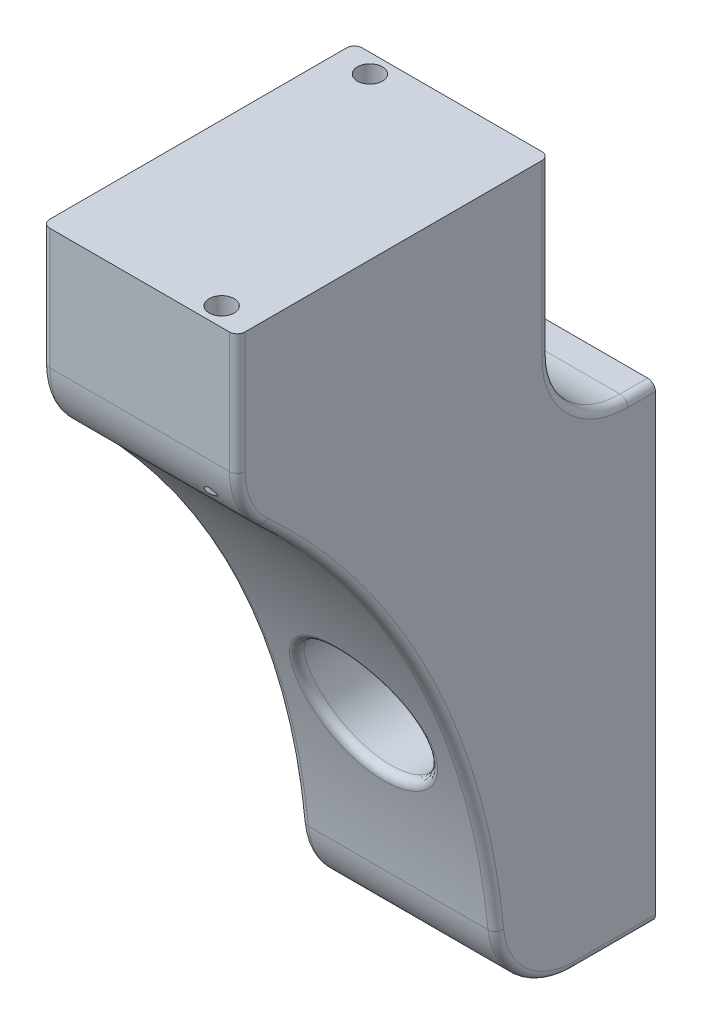
from build123d import *

# Parameters (mm, degrees)
BOSS_EXTRUDE1_DEPTH     = 7.9375
CUT_EXTRUDE1_DEPTH      = 69.000110012
CUT_EXTRUDE1_DEPTH_BACK = 69.000110012
SKETCH2_R               = 3.175
CUT_EXTRUDE4_START      = 6.35
SKETCH2_3_R             = 5.08
SKETCH2_3_R_2           = 3.175
CUT_EXTRUDE4_DEPTH      = 62.650110074
SKETCH3_R               = 1.016
CUT_EXTRUDE2_DEPTH      = 12.7
FILLET1_R               = 6.35
FILLET2_R               = 0.635


with BuildPart() as part:
    # Sketch1 → Boss-Extrude1 (new, symmetric)
    with BuildSketch(Plane(origin=(0, 0, 0), x_dir=(0, 0, -1), z_dir=(1, 0, 0))):
        with BuildLine():
            Line((-12.7, 0), (0, 0))
            Line((0, 0), (0, 38.1))
            Line((0, 38.1), (-8.603985801, 38.1))
            Line((-8.603985801, 38.1), (-8.603985801, 58.35015))
            Line((-8.603985801, 58.35015), (-34.003985801, 58.35015))
            Line((-34.003985801, 58.35015), (-34.003985801, 45.65015))
            ThreePointArc((-34.003985801, 45.65015), (-18.28813969, 25.18827111), (-12.7, 0))
        make_face()
    extrude(amount=BOSS_EXTRUDE1_DEPTH, both=True)

    # Sketch2 → Cut-Extrude1 (cut, two sides: drawn at the far end of the back side and taken through both)
    with BuildSketch(Plane.XY.offset(-CUT_EXTRUDE1_DEPTH_BACK)):
        with Locations((0, 19.05)):
            Circle(SKETCH2_R)
    extrude(amount=CUT_EXTRUDE1_DEPTH + CUT_EXTRUDE1_DEPTH_BACK, mode=Mode.SUBTRACT)

    # Sketch2<3> → Cut-Extrude4 (cut, through all)
    with BuildSketch(Plane.XY.offset(CUT_EXTRUDE4_START)):
        with Locations((0, 19.05)):
            Circle(SKETCH2_3_R)
        with Locations((0, 19.05)):
            Circle(SKETCH2_3_R_2, mode=Mode.SUBTRACT)
    extrude(amount=CUT_EXTRUDE4_DEPTH, mode=Mode.SUBTRACT)

    # Sketch3 → Cut-Extrude2 (cut)
    with BuildSketch(Plane(origin=(0, 58.35015, 0), x_dir=(1, 0, 0), z_dir=(0, 1, 0))):
        with Locations((-5.14985, -10.128440702)):
            Circle(SKETCH3_R)
        with Locations((5.14985, -32.479530901)):
            Circle(SKETCH3_R)
    extrude(amount=-CUT_EXTRUDE2_DEPTH, mode=Mode.SUBTRACT)

    # Fillet1
    fillet1_edges = [part.edges().sort_by_distance(p)[0] for p in [
        (0, 38.1, 8.603985801),
        (0, 0, 12.7),
        (0, 45.65015, 34.003985801),
    ]]
    fillet(fillet1_edges, radius=FILLET1_R)

    # Fillet2
    fillet2_edges = [part.edges().sort_by_distance(p)[0] for p in [
        (-7.9375, 38.1, 1.126992901),
        (-7.9375, 39.959871939, 6.744113862),
        (7.9375, 38.1, 1.126992901),
        (7.9375, 39.959871939, 6.744113862),
        (-7.9375, 0, 3.328298297),
        (-7.9375, 1.648552323, 10.924955733),
        (-7.9375, 26.546479972, 18.943050417),
        (-7.9375, 45.970406475, 33.468275281),
        (7.9375, 0, 3.328298297),
        (7.9375, 1.648552323, 10.924955733),
        (7.9375, 26.546479972, 18.943050417),
        (7.9375, 45.970406475, 33.468275281),
        (-7.9375, 51.400075, 8.603985801),
        (7.9375, 51.400075, 8.603985801),
        (-7.9375, 53.436653755, 34.003985801),
        (7.9375, 53.436653755, 34.003985801),
        (-5.078897735, 19.155819437, 15.864451719),
    ]]
    fillet(fillet2_edges, radius=FILLET2_R)


solid = part.part
